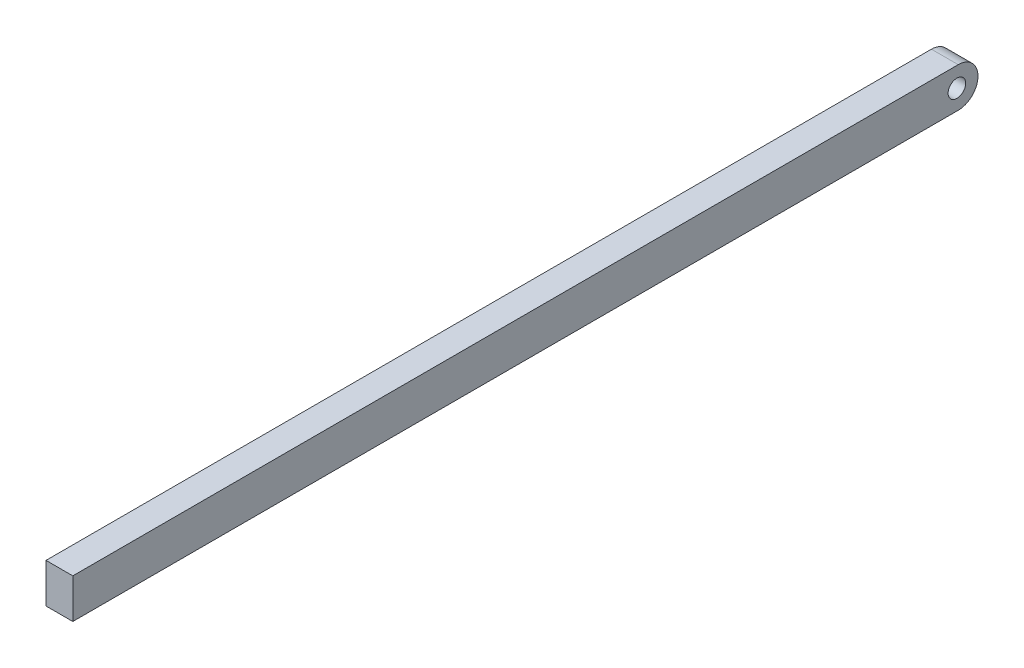
from build123d import *

# Parameters (mm, degrees)
SKETCH1_W           = 6.1
SKETCH1_H           = 9
BOSS_EXTRUDE1_DEPTH = 9.29
SKETCH3_R           = 2
CUT_EXTRUDE2_DEPTH  = 12.990166805
SKETCH4_W           = 6.1
SKETCH4_H           = 9
BOSS_EXTRUDE2_DEPTH = 196.7


with BuildPart() as part:
    # Sketch1 → Boss-Extrude1 (new body)
    with BuildSketch(Plane.XY):
        Rectangle(SKETCH1_W, SKETCH1_H)
    extrude(amount=BOSS_EXTRUDE1_DEPTH)

    # Sketch3 → Cut-Extrude2 (cut, through all)
    with BuildSketch(Plane(origin=(3.05, 0, 0), x_dir=(0, 0, -1), z_dir=(1, 0, 0))):
        with BuildLine():
            ThreePointArc((-4.5, 4.5), (-1.318019485, 3.181980515), (0, 0))
            Line((0, 0), (0, 4.5))
            Line((0, 4.5), (-4.5, 4.5))
        make_face()
        with BuildLine():
            ThreePointArc((0, 0), (-1.318019485, -3.181980515), (-4.5, -4.5))
            Line((-4.5, -4.5), (0, -4.5))
            Line((0, -4.5), (0, 0))
        make_face()
        with Locations((-4.8, 0)):
            Circle(SKETCH3_R)
    extrude(amount=-CUT_EXTRUDE2_DEPTH, mode=Mode.SUBTRACT)

    # Sketch4 → Boss-Extrude2 (add)
    with BuildSketch(Plane.XY.offset(9.29)):
        Rectangle(SKETCH4_W, SKETCH4_H)
    extrude(amount=BOSS_EXTRUDE2_DEPTH)


solid = part.part
